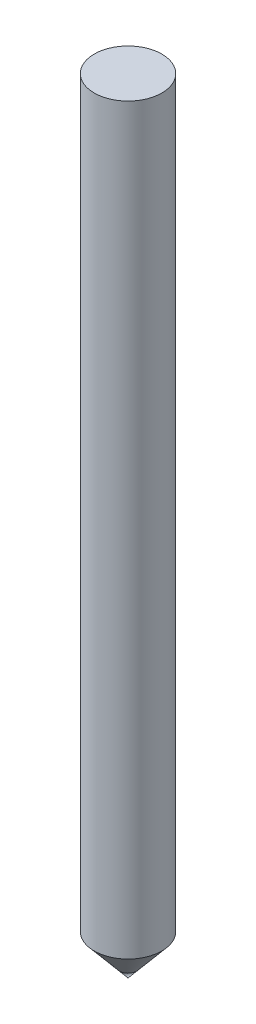
from build123d import *

# Parameters (mm, degrees)
SKETCH1_R           = 5
BOSS_EXTRUDE1_DEPTH = 110


with BuildPart() as part:
    # Sketch1 → Boss-Extrude1 (new body)
    with BuildSketch(Plane(origin=(0, 0, 0), x_dir=(1, 0, 0), z_dir=(0, 1, 0))):
        with Locations(Location((0, 0, 0), (0, 0, 270))):
            Circle(SKETCH1_R)
    extrude(amount=BOSS_EXTRUDE1_DEPTH)

    # Boss-Extrude2 cone 1 section (through the dimple's axis) → Boss-Extrude2 (revolve)
    with BuildSketch(Plane(origin=(0, 0, 0), x_dir=(0, 0, 1), z_dir=(1, 0, 0))):
        Polygon((0, 0), (5, 0), (0, 5.958767963), align=None)
    revolve(axis=Axis((0, 0, 0), (0, -1, 0)))


solid = part.part
